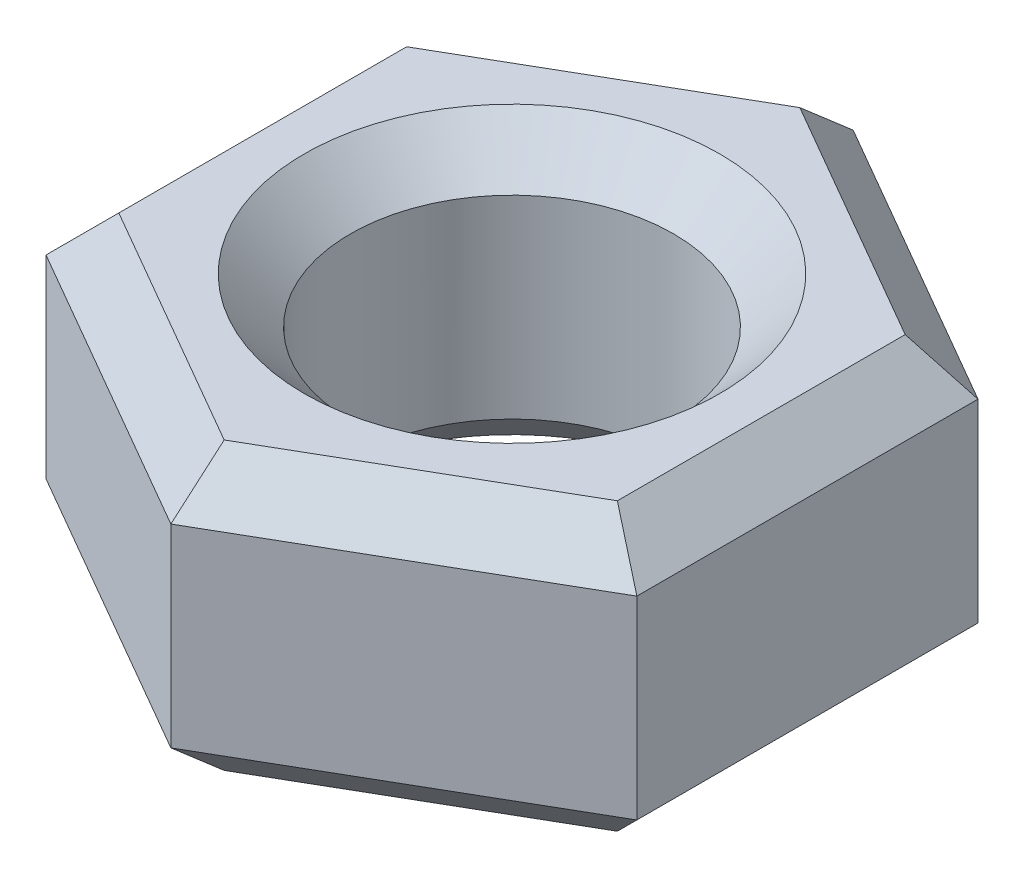
from build123d import *

# Parameters (mm, degrees)
SKETCH1_R           = 3.5
BOSS_EXTRUDE1_DEPTH = 6.2
CHAMFER1_SIZE       = 1


with BuildPart() as part:
    # Sketch1 → Boss-Extrude1 (new body)
    with BuildSketch(Plane(origin=(0, 0, 0), x_dir=(1, 0, 0), z_dir=(0, 1, 0))):
        Polygon((6.4, -3.695041723), (6.4, 3.695041723), (0, 7.390083446), (-6.4, 3.695041723), (-6.4, -3.695041723), (0, -7.390083446), align=None)
        with Locations(Location((0, 0, 0), (0, 0, 90))):
            Circle(SKETCH1_R, mode=Mode.SUBTRACT)
    extrude(amount=BOSS_EXTRUDE1_DEPTH)

    # Chamfer1
    chamfer1_edges = [part.edges().sort_by_distance(p)[0] for p in [
        (3.2, 6.2, -5.542562584),
        (-3.2, 6.2, -5.542562584),
        (-6.4, 6.2, 0),
        (0, 0, 3.5),
        (0, 6.2, 3.5),
        (-3.2, 6.2, 5.542562584),
        (3.2, 6.2, 5.542562584),
        (-3.2, 0, 5.542562584),
        (-6.4, 0, 0),
        (-3.2, 0, -5.542562584),
        (6.4, 6.2, 0),
        (3.2, 0, -5.542562584),
        (6.4, 0, 0),
        (3.2, 0, 5.542562584),
    ]]
    chamfer(chamfer1_edges, length=CHAMFER1_SIZE)


solid = part.part
